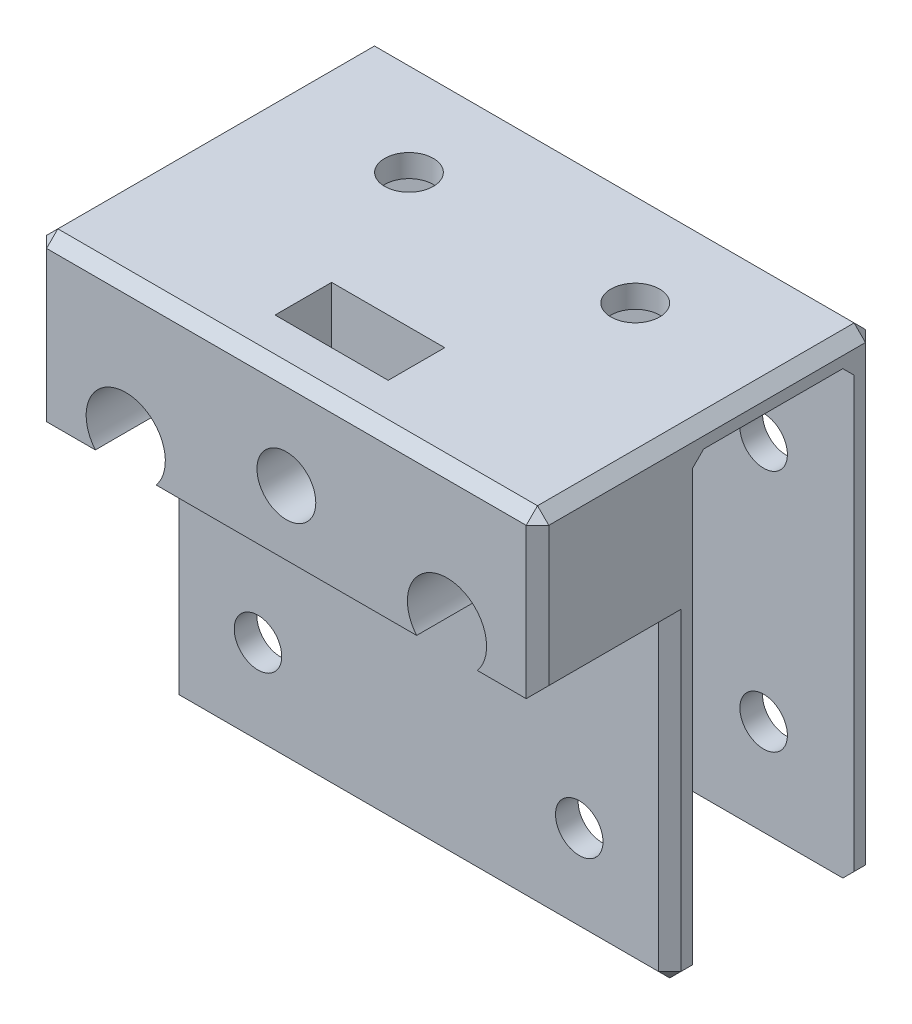
from build123d import *

# Parameters (mm, degrees)
SKETCH1_W           = 44.4
SKETCH1_H           = 40
SKETCH1_R           = 2.1
BOSS_EXTRUDE1_DEPTH = 2
SKETCH2_W           = 44.4
SKETCH2_H           = 18.3
BOSS_EXTRUDE2_DEPTH = 2
LPATTERN1_COUNT     = 2
LPATTERN1_PITCH     = 16.3
SKETCH3_R           = 2.15
CUT_EXTRUDE1_DEPTH  = 64.253853638
BOSS_EXTRUDE3_START = -22.2
SKETCH6_W           = 11.69
SKETCH6_H           = 14.27
BOSS_EXTRUDE3_DEPTH = 44.4
CUT_EXTRUDE2_REACH  = 70.079
SKETCH7_R           = 2.6
CUT_EXTRUDE3_REACH  = 65.254
SKETCH8_R           = 2.1
SKETCH9_R           = 3.5
CUT_EXTRUDE4_DEPTH  = 11.69
FILLET4_SIZE        = 1
SKETCH11_W          = 10
SKETCH11_H          = 5
CUT_EXTRUDE6_DEPTH  = 12.27


with BuildPart() as part:
    # Sketch1 → Boss-Extrude1 (new body)
    with BuildSketch(Plane.XY):
        with Locations((22.2, 20)):
            Rectangle(SKETCH1_W, SKETCH1_H)
        with Locations((8, 8.476902454)):
            Circle(SKETCH1_R, mode=Mode.SUBTRACT)
        with Locations((8, 29.976902454)):
            Circle(SKETCH1_R, mode=Mode.SUBTRACT)
        with Locations((36.4, 29.976902454)):
            Circle(SKETCH1_R, mode=Mode.SUBTRACT)
        with Locations((36.4, 8.476902454)):
            Circle(SKETCH1_R, mode=Mode.SUBTRACT)
    boss_extrude1 = extrude(amount=BOSS_EXTRUDE1_DEPTH)

    # Sketch2 → Boss-Extrude2 (add)
    with BuildSketch(Plane(origin=(0, 40, 0), x_dir=(1, 0, 0), z_dir=(0, 1, 0))):
        with Locations((22.2, 7.15)):
            Rectangle(SKETCH2_W, SKETCH2_H)
    extrude(amount=BOSS_EXTRUDE2_DEPTH)

    # LPattern1: Boss-Extrude1 ×2
    with Locations(*[(0, 0, -i * LPATTERN1_PITCH) for i in range(1, LPATTERN1_COUNT)]):
        add(boss_extrude1)

    # Sketch3 → Cut-Extrude1 (cut, through all)
    with BuildSketch(Plane(origin=(0, 42, 0), x_dir=(1, 0, 0), z_dir=(0, 1, 0))):
        with Locations(Location((12.2, 7.15, 0), (0, 0, 270))):
            Circle(SKETCH3_R)
        with Locations(Location((32.2, 7.15, 0), (0, 0, 270))):
            Circle(SKETCH3_R)
    extrude(amount=-CUT_EXTRUDE1_DEPTH, mode=Mode.SUBTRACT)

    # Sketch6 → Boss-Extrude3 (add)
    with BuildSketch(Plane(origin=(22.2, 0, 0), x_dir=(0, 0, -1), z_dir=(1, 0, 0)).offset(BOSS_EXTRUDE3_START)):
        with Locations((-7.845, 34.865)):
            Rectangle(SKETCH6_W, SKETCH6_H)
    extrude(amount=BOSS_EXTRUDE3_DEPTH)

    # Sketch7 → Cut-Extrude2 (cut, up to next)
    with BuildSketch(Plane.XY.offset(13.69), mode=Mode.PRIVATE) as cut_extrude2_sk1:
        with Locations((22.2, 33.43)):
            Circle(SKETCH7_R)
    cut_extrude2_tool1 = extrude(cut_extrude2_sk1.sketch, amount=-CUT_EXTRUDE2_REACH, mode=Mode.PRIVATE) & part.part
    add(cut_extrude2_tool1.solids().sort_by_distance((22.2, 33.43, 13.69))[0], mode=Mode.SUBTRACT)

    # Sketch8 → Cut-Extrude3 (cut, up to next)
    with BuildSketch(Plane(origin=(0, 0, 0), x_dir=(-1, 0, 0), z_dir=(0, 0, -1)), mode=Mode.PRIVATE) as cut_extrude3_sk1:
        with Locations(Location((-36.4, 29.976902454, 0), (0, 0, 90))):
            Circle(SKETCH8_R)
    cut_extrude3_tool1 = extrude(cut_extrude3_sk1.sketch, amount=-CUT_EXTRUDE3_REACH, mode=Mode.PRIVATE) & part.part
    # Sketch8 → Cut-Extrude3 (cut, up to next)
    with BuildSketch(Plane(origin=(0, 0, 0), x_dir=(-1, 0, 0), z_dir=(0, 0, -1)), mode=Mode.PRIVATE) as cut_extrude3_sk2:
        with Locations(Location((-8, 29.976902454, 0), (0, 0, 90))):
            Circle(SKETCH8_R)
    cut_extrude3_tool2 = extrude(cut_extrude3_sk2.sketch, amount=-CUT_EXTRUDE3_REACH, mode=Mode.PRIVATE) & part.part
    add(cut_extrude3_tool1.solids().sort_by_distance((36.4, 29.976902, 0))[0], mode=Mode.SUBTRACT)
    add(cut_extrude3_tool2.solids().sort_by_distance((8, 29.976902, 0))[0], mode=Mode.SUBTRACT)

    # Sketch9 → Cut-Extrude4 (cut)
    with BuildSketch(Plane.XY.offset(13.69)):
        with Locations((8, 29.976902454)):
            Circle(SKETCH9_R)
        with Locations((36.4, 29.976902454)):
            Circle(SKETCH9_R)
    extrude(amount=-CUT_EXTRUDE4_DEPTH, mode=Mode.SUBTRACT)

    # Fillet4
    fillet4_edges = [part.edges().sort_by_distance(p)[0] for p in [
        (44.4, 13.865, 2),
        (0, 21, -16.3),
        (44.4, 21, -16.3),
        (0, 42, -1.305),
        (44.4, 42, -1.305),
        (22.2, 42, -16.3),
        (22.2, 40, -14.3),
        (22.2, 0, -16.3),
        (0, 0, -15.3),
        (44.4, 0, -15.3),
        (22.2, 40, 0),
        (0, 13.865, 2),
        (44.4, 27.73, 7.845),
        (44.4, 34.865, 13.69),
        (22.2, 42, 13.69),
        (0, 27.73, 7.845),
        (0, 34.865, 13.69),
        (44.4, 0, 1),
        (0, 0, 1),
        (22.2, 0, 2),
    ]]
    chamfer(fillet4_edges, length=FILLET4_SIZE)

    # Sketch11 → Cut-Extrude6 (cut)
    with BuildSketch(Plane(origin=(0, 42, 0), x_dir=(1, 0, 0), z_dir=(0, 1, 0))):
        with Locations((22.2, -7.19)):
            Rectangle(SKETCH11_W, SKETCH11_H)
    extrude(amount=-CUT_EXTRUDE6_DEPTH, mode=Mode.SUBTRACT)


solid = part.part
